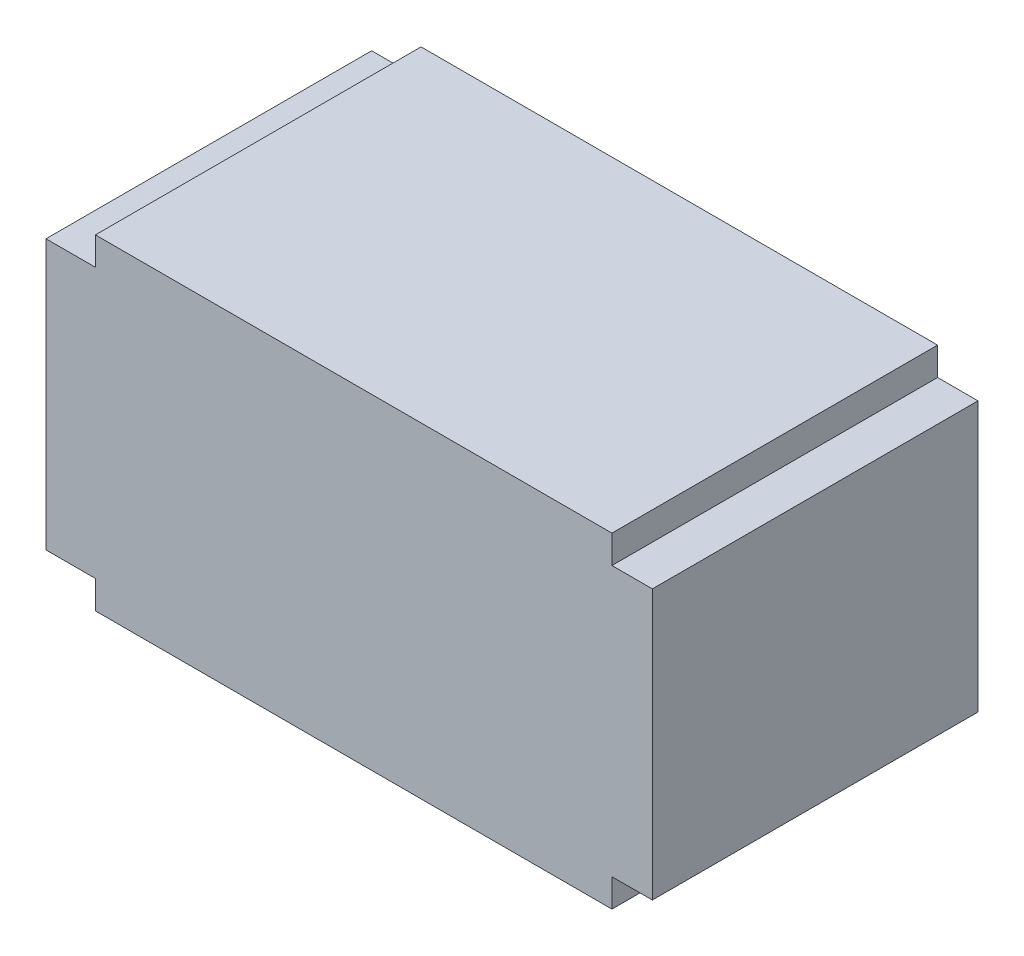
from build123d import *

# Parameters (mm, degrees)
COMPONENT_OUTLINE_DEPTH = 1.45


with BuildPart() as part:
    # 草图1 → Component_Outline (new body)
    with BuildSketch(Plane.XY):
        Polygon((1.35, -0.6), (1.17, -0.6), (1.17, -0.725), (-1.13, -0.725), (-1.13, -0.6), (-1.35, -0.6), (-1.35, 0.6), (-1.13, 0.6), (-1.13, 0.725), (1.17, 0.725), (1.17, 0.6), (1.35, 0.6), align=None)
    extrude(amount=COMPONENT_OUTLINE_DEPTH)


solid = part.part
